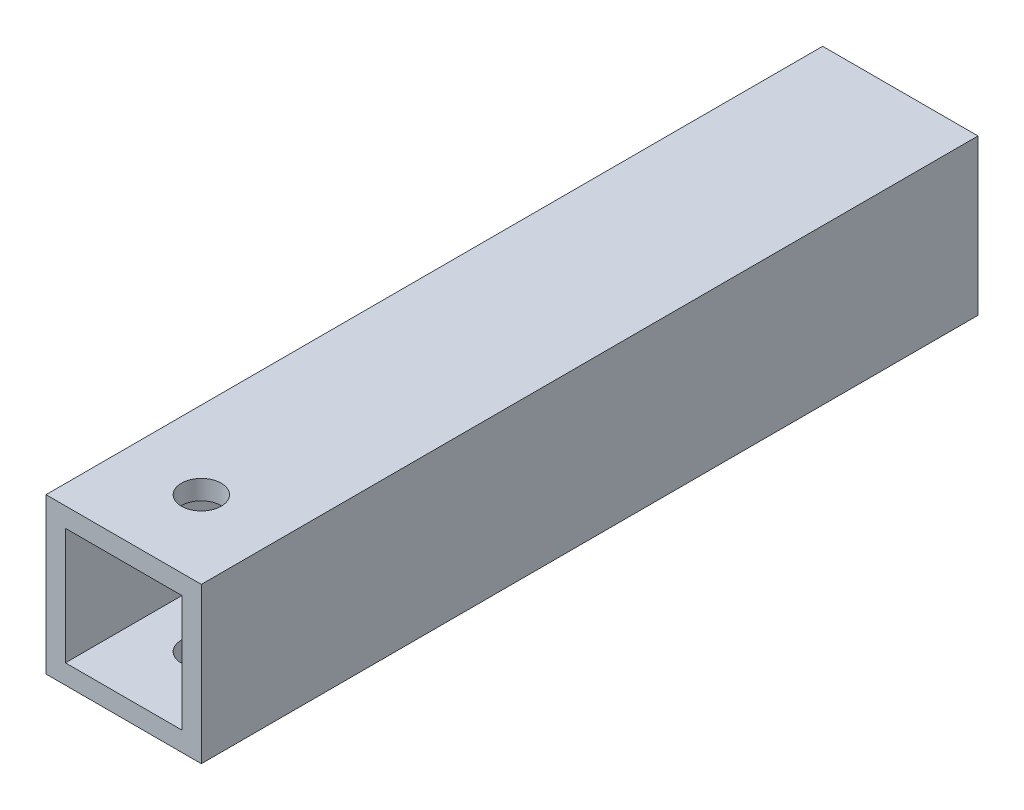
from build123d import *

# Parameters (mm, degrees)
SKETCH1_W               = 25.4
SKETCH1_H               = 25.4
BOSS_EXTRUDE1_DEPTH     = 127
SKETCH2_W               = 19.05
SKETCH2_H               = 19.05
CUT_EXTRUDE1_DEPTH      = 129.263712717
CUT_EXTRUDE2_DEPTH      = 131.136274728
CUT_EXTRUDE2_DEPTH_BACK = 131.136274728
SKETCH3_R               = 3.2639


with BuildPart() as part:
    # Sketch1 → Boss-Extrude1 (new body)
    with BuildSketch(Plane.XY):
        Rectangle(SKETCH1_W, SKETCH1_H)
    extrude(amount=BOSS_EXTRUDE1_DEPTH)

    # Sketch2 → Cut-Extrude1 (cut, through all)
    with BuildSketch(Plane.XY):
        Rectangle(SKETCH2_W, SKETCH2_H)
    extrude(amount=CUT_EXTRUDE1_DEPTH, mode=Mode.SUBTRACT)

    # Sketch3 → Cut-Extrude2 (cut, two sides: drawn at the far end of the back side and taken through both)
    with BuildSketch(Plane(origin=(0, 12.7, 0), x_dir=(1, 0, 0), z_dir=(0, 1, 0)).offset(-CUT_EXTRUDE2_DEPTH_BACK)):
        with Locations(Location((0, -114.3, 0), (0, 0, 90))):
            Circle(SKETCH3_R)
    extrude(amount=CUT_EXTRUDE2_DEPTH + CUT_EXTRUDE2_DEPTH_BACK, mode=Mode.SUBTRACT)


solid = part.part
